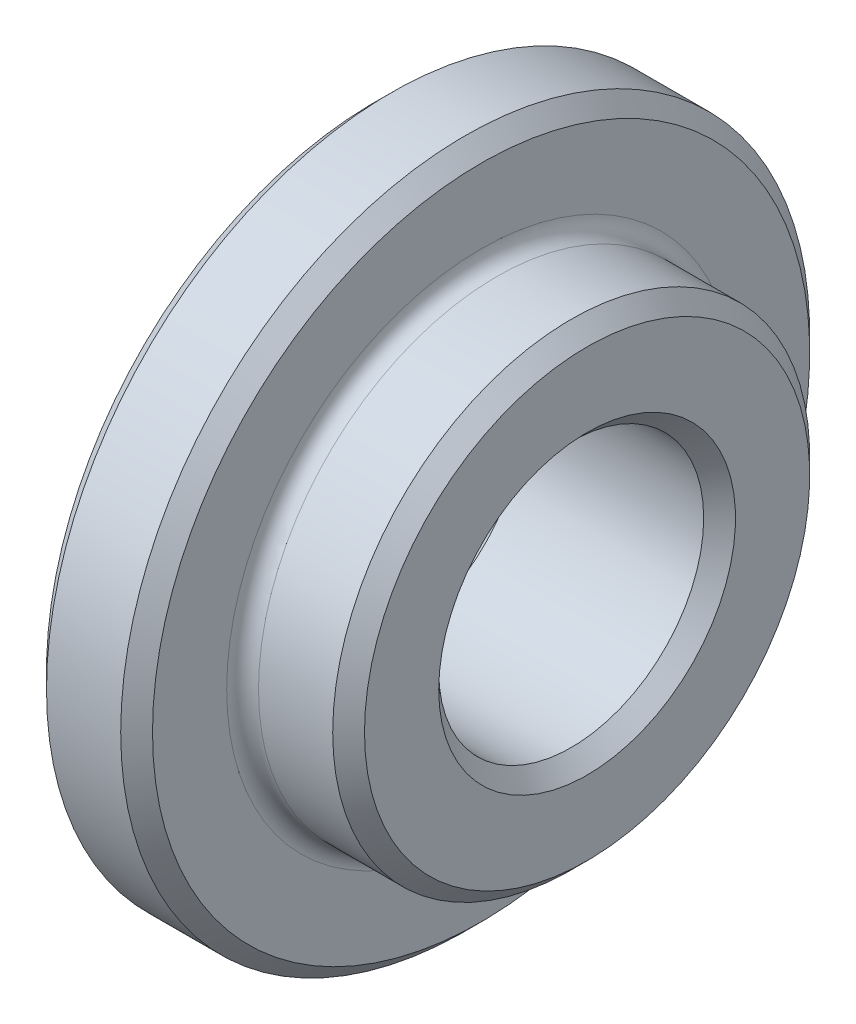
from build123d import *

# Parameters (mm, degrees)
ZAOBLIT1_R   = 0.3
ZKOSIT1_SIZE = 0.3


with BuildPart() as part:
    # Skica1 → Otočit kolem osy1 (revolve)
    with BuildSketch(Plane.XY, mode=Mode.PRIVATE) as oto_it_kolem_osy1_sk:
        Polygon((0, 2.5), (4, 2.5), (4, 4.5), (2, 4.5), (2, 6.5), (0, 6.5), align=None)
    revolve(oto_it_kolem_osy1_sk.sketch.rotate(Axis((0, 0, 0), (1, 0, 0)), 90), axis=Axis((0, 0, 0), (1, 0, 0)))

    # Zaoblit1
    zaoblit1_edges = [part.edges().sort_by_distance(p)[0] for p in [
        (2, 0, -4.5),
    ]]
    fillet(zaoblit1_edges, radius=ZAOBLIT1_R)

    # Zkosit1
    zkosit1_edges = [part.edges().sort_by_distance(p)[0] for p in [
        (0, 0, -6.5),
        (2, 0, -6.5),
        (4, 0, -4.5),
        (4, 0, -2.5),
        (0, 0, -2.5),
    ]]
    chamfer(zkosit1_edges, length=ZKOSIT1_SIZE)


solid = part.part
